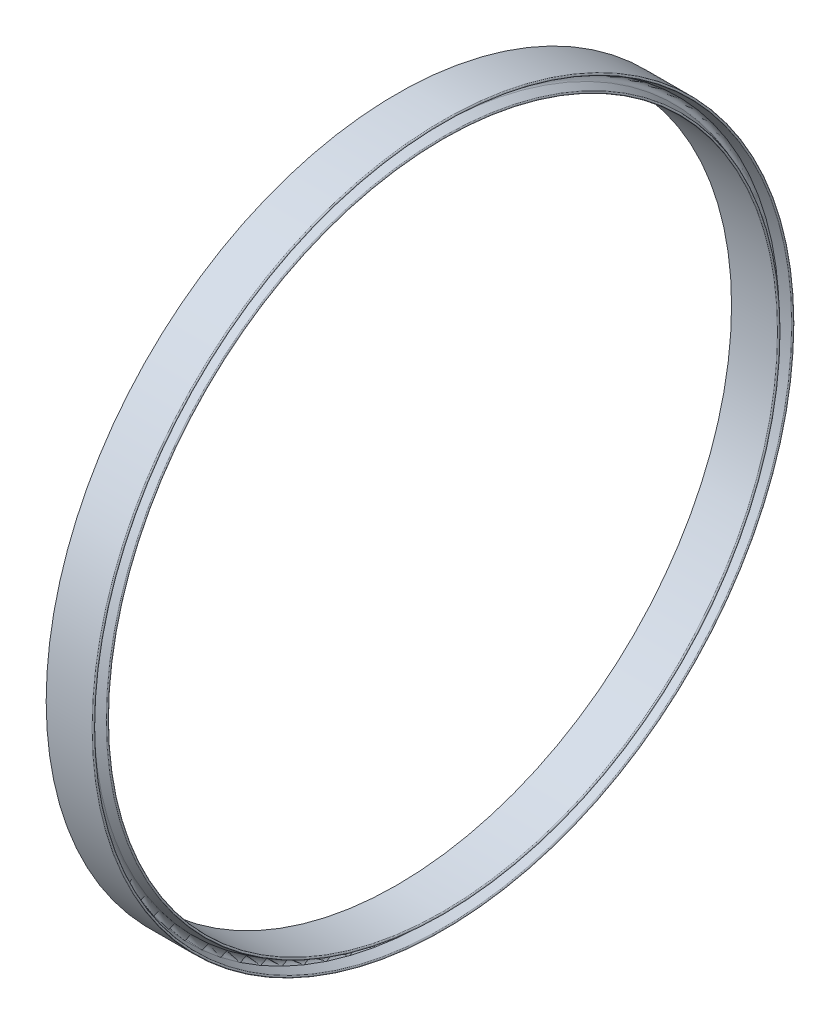
from build123d import *


with BuildPart() as part:
    # Sketch1 → Revolve1 (revolve)
    with BuildSketch(Plane.XY, mode=Mode.PRIVATE) as revolve1_sk:
        with BuildLine():
            Line((-62.75243655, -33), (-58.433780101, -33))
            ThreePointArc((-58.433780101, -33), (-58.334840061, -32.914521314), (-58.405045312, -32.804217371))
            Line((-58.405045312, -32.804217371), (-59.294610265, -32.537347886))
            ThreePointArc((-59.294610265, -32.537347886), (-59.508405899, -32.25), (-59.294610265, -31.962652114))
            Line((-59.294610265, -31.962652114), (-58.405045312, -31.695782629))
            ThreePointArc((-58.405045312, -31.695782629), (-58.334840061, -31.585478686), (-58.433780101, -31.5))
            Line((-58.433780101, -31.5), (-62.75243655, -31.5))
            Line((-62.75243655, -31.5), (-62.75243655, -33))
        make_face()
    revolve(revolve1_sk.sketch.rotate(Axis((-79.12263739, 0, 0), (1, 0, 0)), 270), axis=Axis((-79.12263739, 0, 0), (1, 0, 0)))


solid = part.part
